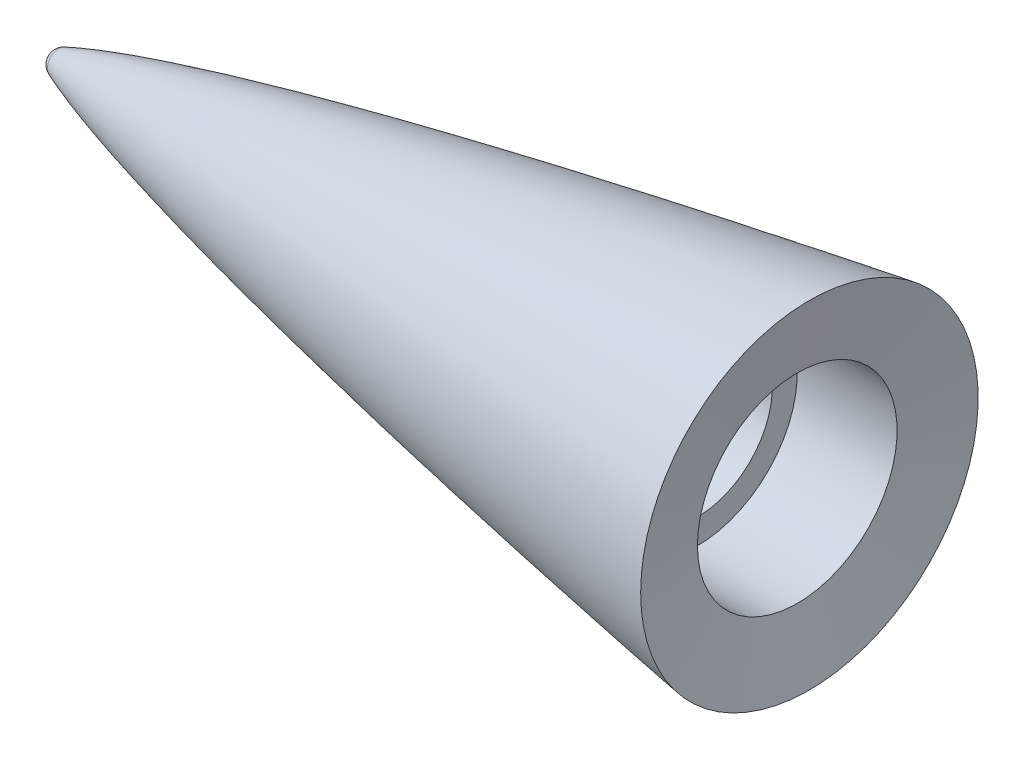
from build123d import *


with BuildPart() as part:
    # Sketch1 → Revolve2 (revolve)
    with BuildSketch(Plane(origin=(0, 0, 0), x_dir=(1, 0, 0), z_dir=(0, 1, 0)), mode=Mode.PRIVATE) as revolve2_sk:
        with BuildLine():
            Line((1.697321091, 0), (45.819405393, 0))
            Line((45.819405393, 0), (58.519405393, 9.525))
            Line((58.519405393, 9.525), (83.919405393, 9.525))
            Line((83.919405393, 9.525), (83.919405393, 12.7))
            Line((83.919405393, 12.7), (96.619405393, 12.7))
            Line((96.619405393, 12.7), (98.165428581, 21.4679332))
            add(Edge.make_bspline(
                [(2.682127148, 1.468644362), (2.982092127, 1.591742283), (3.982765764, 1.986976913), (6.075542743, 2.735585346), (9.959285205, 3.961402854), (15.35260807, 5.458934046), (21.847317263, 7.086678944), (29.055363889, 8.749177841), (36.286920774, 10.313744718), (43.531901048, 11.801111844), (50.793776988, 13.226984496), (58.058153921, 14.599266319), (64.433980883, 15.762645369), (69.883896781, 16.732062359), (74.459068804, 17.529825957), (78.065425347, 18.150661812), (81.784961377, 18.781283529), (85.307065103, 19.372441088), (89.168740248, 20.010357493), (92.45838759, 20.54964543), (95.664328261, 21.067043036), (97.333372349, 21.334925019), (98.164963492, 21.467858845), (98.165428581, 21.4679332)],
                knots=[0.027847292, 0.027847292, 0.027847292, 0.027847292, 0.027847292, 0.039565322, 0.06672611, 0.108155752, 0.174993972, 0.2418322, 0.308670423, 0.375508647, 0.442346873, 0.509185099, 0.576023325, 0.642861549, 0.676280662, 0.709699776, 0.743118888, 0.776538001, 0.809957114, 0.843376227, 0.87679534, 0.910214452, 0.910233153, 0.910233153, 0.910233153, 0.910233153, 0.910233153], degree=4))
            ThreePointArc((2.682127148, 1.468644362), (1.966311917, 0.884132234), (1.697321091, 0))
        make_face()
    revolve(revolve2_sk.sketch.rotate(Axis((0, 0, 0), (1, 0, 0)), 180), axis=Axis((0, 0, 0), (1, 0, 0)))


solid = part.part
